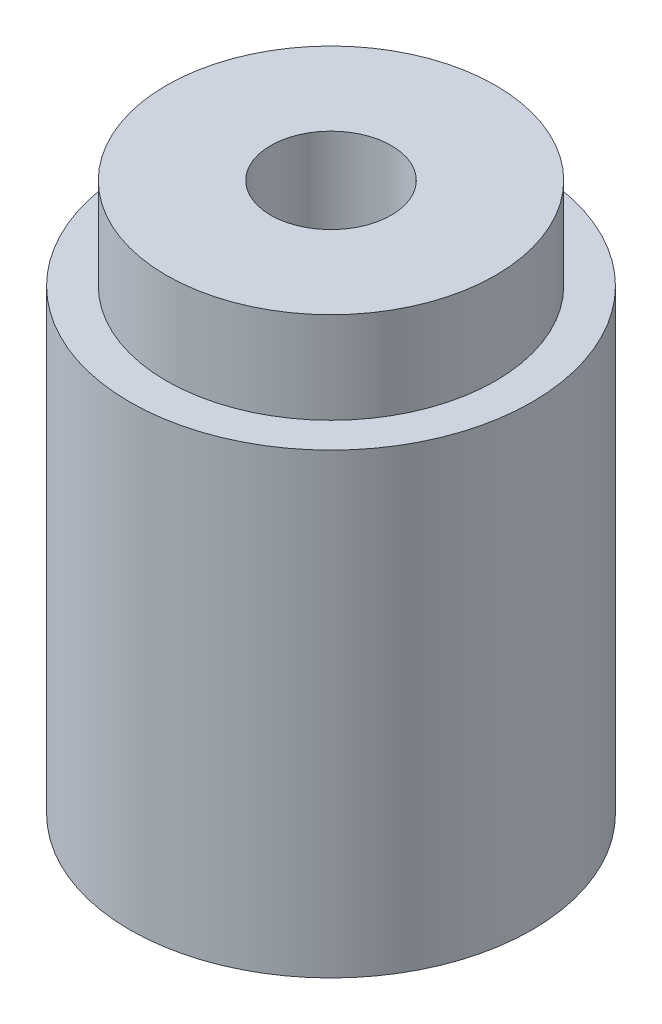
from build123d import *


with BuildPart() as part:
    # Sketch1 → Revolve1 (revolve)
    with BuildSketch(Plane.XY, mode=Mode.PRIVATE) as revolve1_sk:
        Polygon((3.3, 30), (9, 30), (9, 25), (11, 25), (11, 0), (8, 0), (8, 23), (3.3, 23), align=None)
    revolve(revolve1_sk.sketch.rotate(Axis((0, 18.827916691, 0), (0, -1, 0)), 90), axis=Axis((0, 18.827916691, 0), (0, -1, 0)))


solid = part.part
